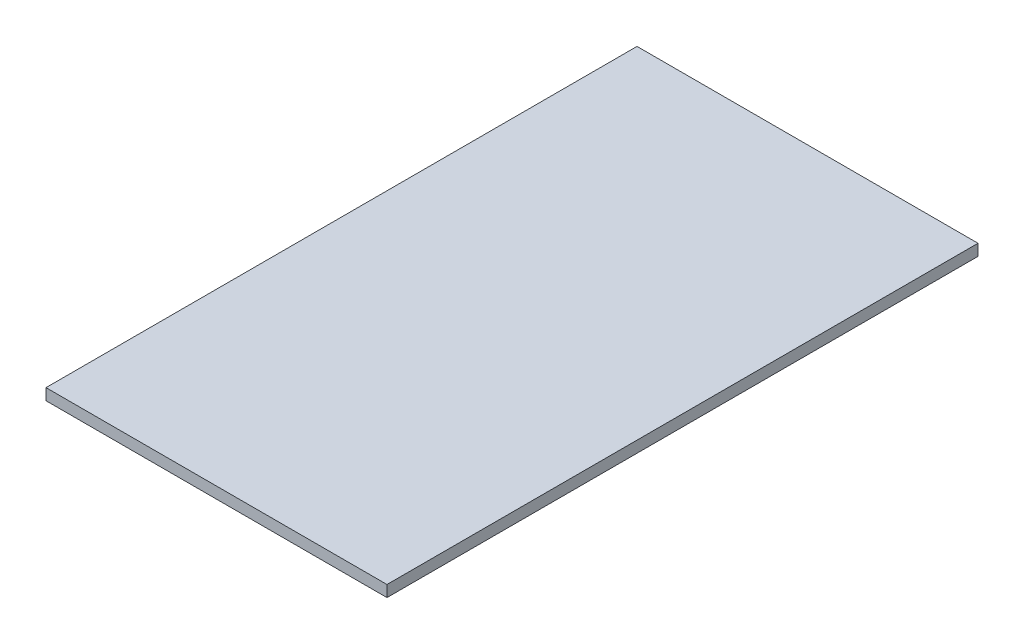
from build123d import *

# Parameters (mm, degrees)
SKETCH1_W           = 300
SKETCH1_H           = 520
BOSS_EXTRUDE1_DEPTH = 10


with BuildPart() as part:
    # Sketch1 → Boss-Extrude1 (new body)
    with BuildSketch(Plane.XZ.offset(-29.143326369)):
        with Locations((-180.300605602, 78.433128803)):
            Rectangle(SKETCH1_W, SKETCH1_H)
    extrude(amount=BOSS_EXTRUDE1_DEPTH)


solid = part.part
